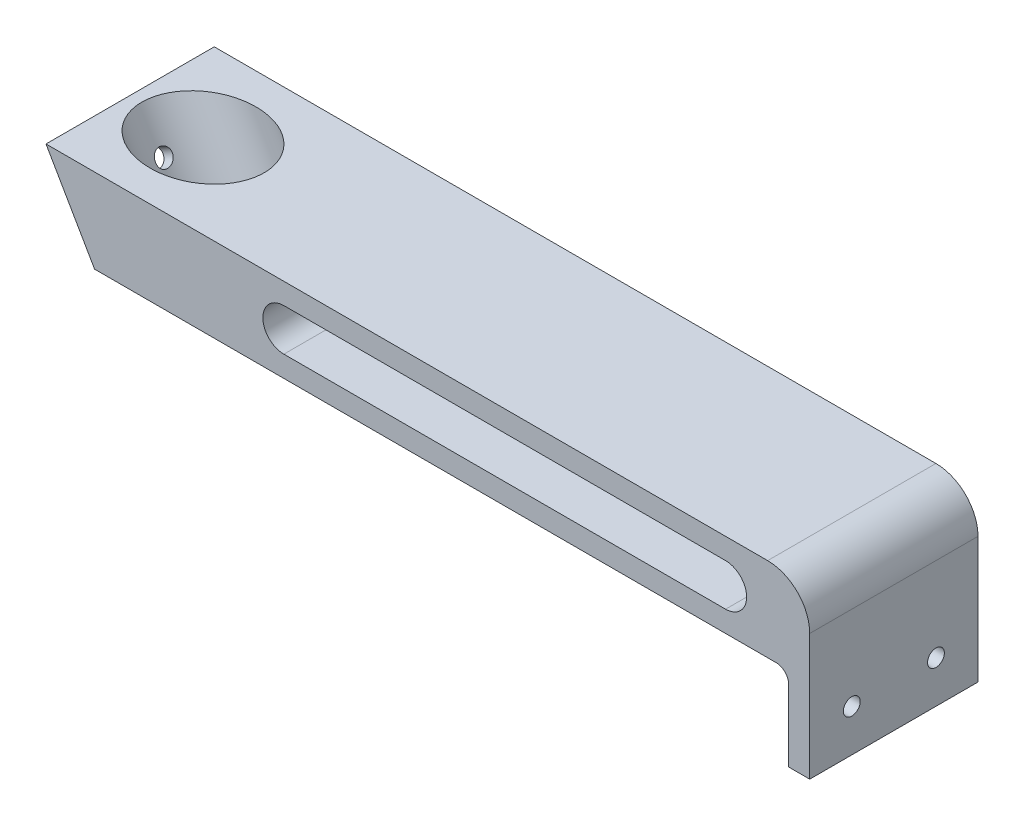
from build123d import *

# Parameters (mm, degrees)
EXTRUDE_1_DEPTH          = 40
SKETCH_2_R               = 12.6
CUT_EXTRUDE_1_DEPTH      = 187.974102923
CUT_EXTRUDE_2_REACH      = 177.784
CUT_EXTRUDE_2_END_RADIUS = 12.6
SKETCH_3_R               = 2
SKETCH_4_W               = 5
SKETCH_4_H               = 40
EXTRUDE_2_DEPTH          = 20
SKETCH_5_R               = 2
CUT_EXTRUDE_3_DEPTH      = 183.123159192
FILLET_1_R               = 10
FILLET_2_R               = 3
CUT_EXTRUDE_4_DEPTH      = 176.783958324


with BuildPart() as part:
    # 草图1 → 凸台-拉伸1 (new body)
    with BuildSketch(Plane.XY):
        Polygon((0, 0), (170, 0), (170, 20), (-11.547005384, 20), align=None)
    extrude(amount=EXTRUDE_1_DEPTH)

    # 草图2 → 切除-拉伸1 (cut, through all)
    with BuildSketch(Plane(origin=(-11.547005384, 20, 0), x_dir=(0, 0, -1), z_dir=(-0.4999999999999949, 0.8660254037844416, 0))):
        with Locations(Location((-20, -15, 0), (0, 0, 90))):
            Circle(SKETCH_2_R)
    extrude(amount=-CUT_EXTRUDE_1_DEPTH, mode=Mode.SUBTRACT)

    # 切除-拉伸2: up to this cylinder (the profile starts outside it)
    cut_extrude_2_end = Plane(origin=(7.25676472, 17.430914806, 20), z_dir=(-0.4999999999999949, 0.8660254037844416, 0)) * Cylinder(CUT_EXTRUDE_2_END_RADIUS, 381.768, mode=Mode.PRIVATE)
    # 草图3 → 切除-拉伸2 (cut, up to the surface)
    with BuildSketch(Plane(origin=(0, 0, 0), x_dir=(0, 0, 1), z_dir=(-0.8660254037844417, -0.4999999999999949, 0)), mode=Mode.PRIVATE) as cut_extrude_2_sk1:
        with Locations(Location((20, 11.46723296, 0), (0, 0, 270))):
            Circle(SKETCH_3_R)
    cut_extrude_2_tool1 = extrude(cut_extrude_2_sk1.sketch, amount=-CUT_EXTRUDE_2_REACH, mode=Mode.PRIVATE) - cut_extrude_2_end
    add(cut_extrude_2_tool1.solids().sort_by_distance((-5.733616, 9.930915, 20))[0], mode=Mode.SUBTRACT)

    # 草图4 → 凸台-拉伸2 (add)
    with BuildSketch(Plane.XZ):
        with Locations((167.5, 20)):
            Rectangle(SKETCH_4_W, SKETCH_4_H)
    extrude(amount=EXTRUDE_2_DEPTH)

    # 草图5 → 切除-拉伸3 (cut, through all)
    with BuildSketch(Plane.ZY.offset(-165)):
        with Locations((10, -10)):
            Circle(SKETCH_5_R)
        with Locations(Location((30, -10, 0), (0, 0, 180))):
            Circle(SKETCH_5_R)
    extrude(amount=-CUT_EXTRUDE_3_DEPTH, mode=Mode.SUBTRACT)

    # 圆角1
    fillet_1_edges = [part.edges().sort_by_distance(p)[0] for p in [
        (170, 20, 20),
    ]]
    fillet(fillet_1_edges, radius=FILLET_1_R)

    # 圆角2
    fillet_2_edges = [part.edges().sort_by_distance(p)[0] for p in [
        (165, 0, 20),
    ]]
    fillet(fillet_2_edges, radius=FILLET_2_R)

    # 草图6 → 切除-拉伸4 (cut, through all)
    with BuildSketch(Plane(origin=(0, 0, 0), x_dir=(-1, 0, 0), z_dir=(0, 0, -1))):
        with BuildLine():
            Line((-150, 15), (-45, 15))
            ThreePointArc((-45, 15), (-40, 10), (-45, 5))
            Line((-45, 5), (-150, 5))
            ThreePointArc((-150, 5), (-155, 10), (-150, 15))
        make_face()
    extrude(amount=-CUT_EXTRUDE_4_DEPTH, mode=Mode.SUBTRACT)


solid = part.part
